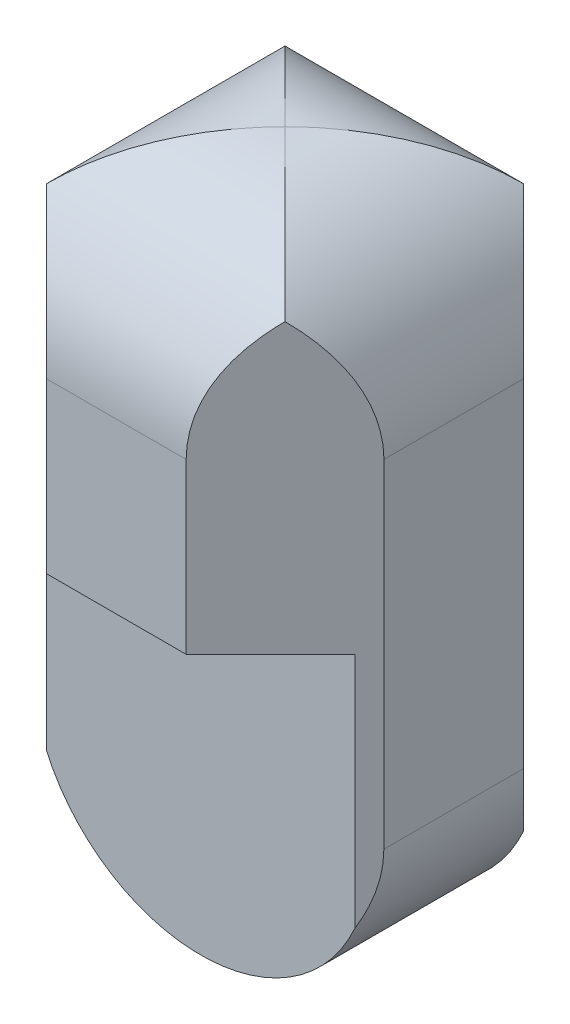
from build123d import *

# Parameters (mm, degrees)
EXTRUDE_1_DEPTH     = 42
CUT_EXTRUDE_1_DEPTH = 66
CUT_EXTRUDE_2_DEPTH = 5
CUT_EXTRUDE_START   = -5
CUT_EXTRUDE_3_DEPTH = 5
CUT_EXTRUDE_5_DEPTH = 30
CUT_EXTRUDE_6_DEPTH = 30


with BuildPart() as part:
    # 草图1 → 凸台-拉伸1 (new body)
    with BuildSketch(Plane(origin=(0, 0, 0), x_dir=(1, 0, 0), z_dir=(0, 1, 0))):
        Polygon((10, 4.142135624), (4.142135624, 10), (-4.142135624, 10), (-10, 4.142135624), (-10, -4.142135624), (-4.142135624, -10), (4.142135624, -10), (10, -4.142135624), align=None)
    extrude(amount=EXTRUDE_1_DEPTH)

    # 草图2 → 切除-拉伸1 (cut)
    with BuildSketch(Plane.XY.offset(10)):
        with BuildLine():
            Line((-10, 10), (-10, -2.389295552))
            Line((-10, -2.389295552), (10, -2.389295552))
            Line((10, -2.389295552), (10, 10))
            ThreePointArc((10, 10), (0, 0), (-10, 10))
        make_face()
    extrude(amount=-CUT_EXTRUDE_1_DEPTH, mode=Mode.SUBTRACT)

    # 草图4 → 切除-拉伸2 (cut)
    with BuildSketch(Plane.XY.offset(10)):
        with BuildLine():
            Line((-10, 10), (-10, 20))
            Line((-10, 20), (10, 20))
            Line((10, 20), (10, 10))
            ThreePointArc((10, 10), (0, 0), (-10, 10))
        make_face()
    extrude(amount=-CUT_EXTRUDE_2_DEPTH, mode=Mode.SUBTRACT)

    # 草图5 → 切除-拉伸3 (cut)
    with BuildSketch(Plane(origin=(0, 0, -10), x_dir=(-1, 0, 0), z_dir=(0, 0, -1)).offset(CUT_EXTRUDE_START)):
        with BuildLine():
            Line((-10, 10), (-10, 20))
            Line((-10, 20), (10, 20))
            Line((10, 20), (10, 10))
            ThreePointArc((10, 10), (0, 0), (-10, 10))
        make_face()
    extrude(amount=CUT_EXTRUDE_3_DEPTH, mode=Mode.SUBTRACT)

    # 草图7 → 切除-拉伸5 (cut)
    with BuildSketch(Plane.XY.offset(10)):
        with BuildLine():
            Line((-10, 30), (-10, 44.883881792))
            Line((-10, 44.883881792), (10, 44.883881792))
            Line((10, 44.883881792), (10, 30))
            ThreePointArc((10, 30), (0, 40), (-10, 30))
        make_face()
    extrude(amount=-CUT_EXTRUDE_5_DEPTH, mode=Mode.SUBTRACT)

    # 草图8 → 切除-拉伸6 (cut)
    with BuildSketch(Plane(origin=(10, 0, 0), x_dir=(0, 0, -1), z_dir=(1, 0, 0))):
        with BuildLine():
            Line((-10, 30), (-10, 44.07560735))
            Line((-10, 44.07560735), (10, 44.07560735))
            Line((10, 44.07560735), (10, 30))
            ThreePointArc((10, 30), (0, 40), (-10, 30))
        make_face()
    extrude(amount=-CUT_EXTRUDE_6_DEPTH, mode=Mode.SUBTRACT)


solid = part.part
